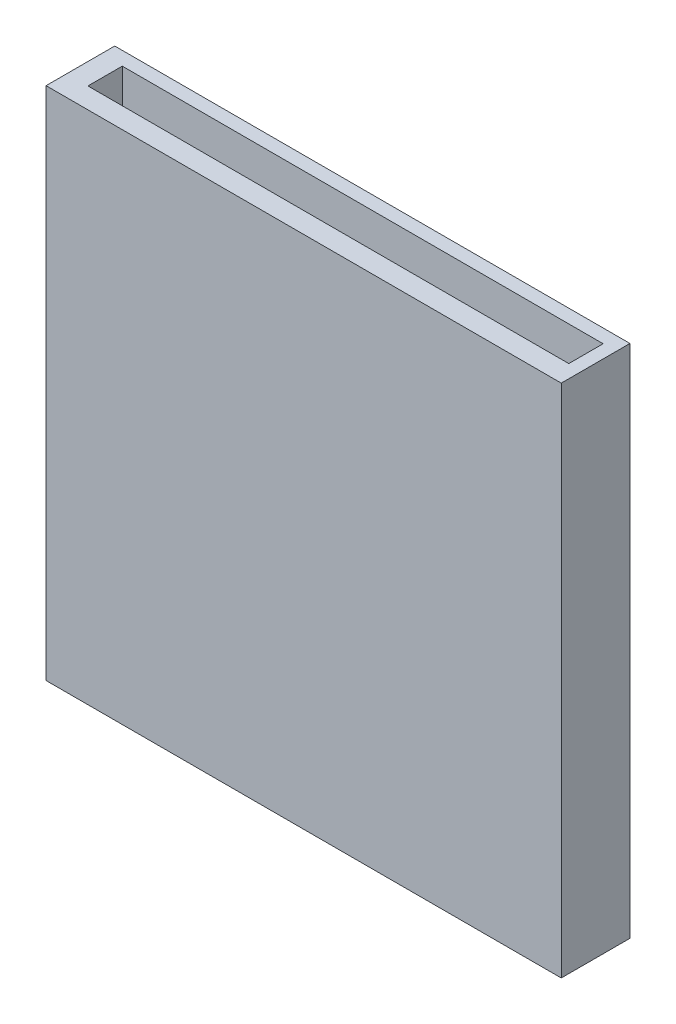
from build123d import *

# Parameters (mm, degrees)
SKETCH_3_W          = 150
SKETCH_3_H          = 20
EXTRUDE_1_DEPTH     = 150
SKETCH_4_W          = 140
SKETCH_4_H          = 10
CUT_EXTRUDE_1_DEPTH = 145


with BuildPart() as part:
    # 草图3 → 凸台-拉伸1 (new body)
    with BuildSketch(Plane(origin=(0, 0, 0), x_dir=(1, 0, 0), z_dir=(0, 1, 0))):
        with Locations((6.015751228, 16.497261118)):
            Rectangle(SKETCH_3_W, SKETCH_3_H)
    extrude(amount=EXTRUDE_1_DEPTH)

    # 草图4 → 切除-拉伸1 (cut)
    with BuildSketch(Plane(origin=(0, 150, 0), x_dir=(1, 0, 0), z_dir=(0, 1, 0))):
        with Locations((7.184361791, 17.520055437)):
            Rectangle(SKETCH_4_W, SKETCH_4_H)
    extrude(amount=-CUT_EXTRUDE_1_DEPTH, mode=Mode.SUBTRACT)


solid = part.part
